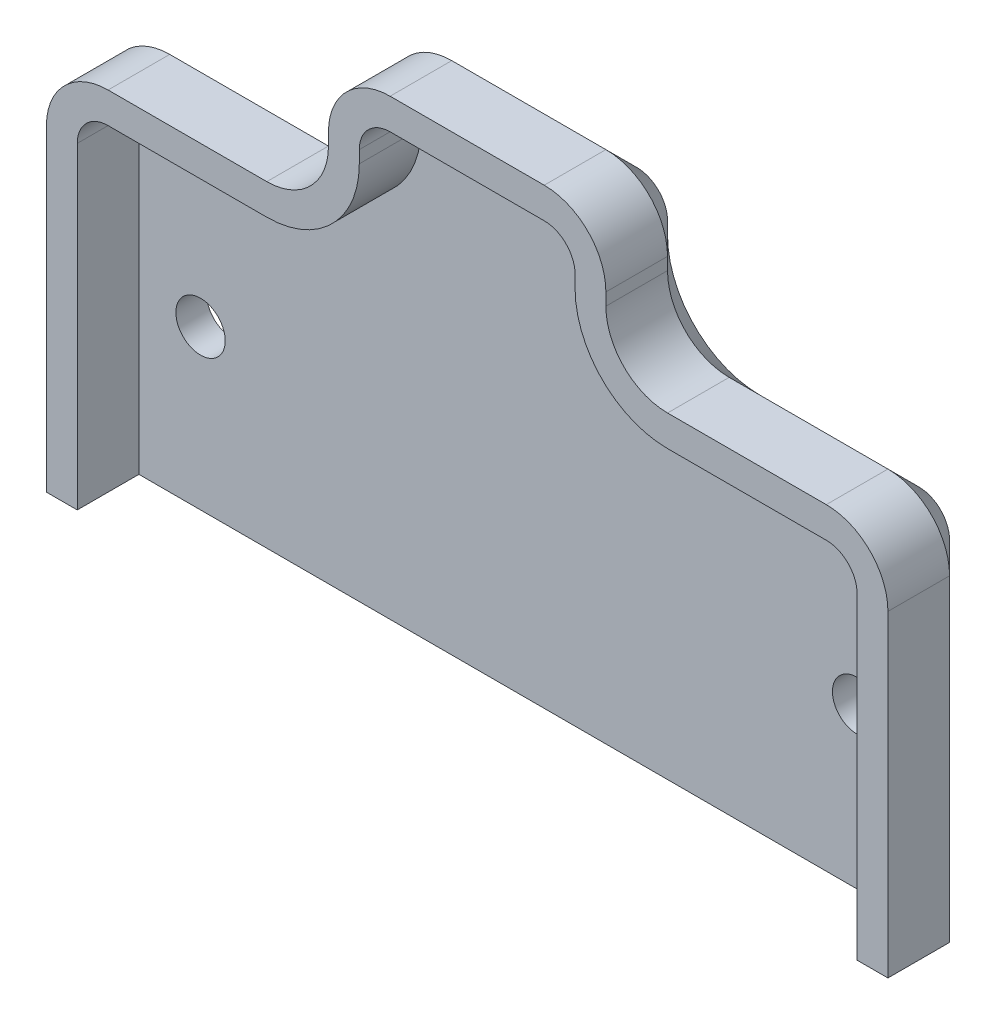
from build123d import *

# Parameters (mm, degrees)
BOSS_EXTRUDE1_DEPTH = 1
BOSS_EXTRUDE2_DEPTH = 2
FILLET1_R           = 1
FILLET2_R           = 2
FILLET3_R           = 3
SKETCH3_R           = 0.8
CUT_EXTRUDE1_DEPTH  = 38.344114593
CHAMFER1_SIZE       = 1


with BuildPart() as part:
    # Sketch1 → Boss-Extrude1 (new body)
    with BuildSketch(Plane.XY):
        Polygon((26.816301055, 5.1920844), (35.966301055, 5.1920844), (35.966301055, -7.1079156), (8.666301055, -7.1079156), (8.666301055, 5.1920844), (17.816301055, 5.1920844), (17.816301055, 9.5920844), (26.816301055, 9.5920844), align=None)
    extrude(amount=BOSS_EXTRUDE1_DEPTH)

    # Sketch2 → Boss-Extrude2 (add)
    with BuildSketch(Plane.XY.offset(1)):
        Polygon((34.966301055, -7.1079156), (34.966301055, 4.1920844), (25.816301055, 4.1920844), (25.816301055, 8.5920844), (18.816301055, 8.5920844), (18.816301055, 4.1920844), (9.666301055, 4.1920844), (9.666301055, -7.1079156), (8.666301055, -7.1079156), (8.666301055, 5.1920844), (17.816301055, 5.1920844), (17.816301055, 9.5920844), (26.816301055, 9.5920844), (26.816301055, 5.1920844), (35.966301055, 5.1920844), (35.966301055, -7.1079156), align=None)
    extrude(amount=BOSS_EXTRUDE2_DEPTH)

    # Fillet1
    fillet1_edges = [part.edges().sort_by_distance(p)[0] for p in [
        (9.666301055, 4.1920844, 2),
        (18.816301055, 8.5920844, 2),
        (25.816301055, 8.5920844, 2),
        (34.966301055, 4.1920844, 2),
    ]]
    fillet(fillet1_edges, radius=FILLET1_R)

    # Fillet2
    fillet2_edges = [part.edges().sort_by_distance(p)[0] for p in [
        (8.666301055, 5.1920844, 1.5),
        (17.816301055, 5.1920844, 1.5),
        (17.816301055, 9.5920844, 1.5),
        (26.816301055, 9.5920844, 1.5),
        (26.816301055, 5.1920844, 1.5),
        (35.966301055, 5.1920844, 1.5),
    ]]
    fillet(fillet2_edges, radius=FILLET2_R)

    # Fillet3
    fillet3_edges = [part.edges().sort_by_distance(p)[0] for p in [
        (18.816301055, 4.1920844, 2),
        (25.816301055, 4.1920844, 2),
    ]]
    fillet(fillet3_edges, radius=FILLET3_R)

    # Sketch3 → Cut-Extrude1 (cut, through all)
    with BuildSketch(Plane(origin=(0, 0, 0), x_dir=(-1, 0, 0), z_dir=(0, 0, -1))):
        with Locations((-32.966301055, -1.9579156)):
            Circle(SKETCH3_R)
        with Locations((-11.666301055, -1.9579156)):
            Circle(SKETCH3_R)
    extrude(amount=-CUT_EXTRUDE1_DEPTH, mode=Mode.SUBTRACT)

    # Chamfer1
    chamfer1_edges = [part.edges().sort_by_distance(p)[0] for p in [
        (13.241301055, 5.1920844, 0),
        (17.816301055, 7.3920844, 0),
        (8.666301055, -1.9579156, 0),
        (35.966301055, -1.9579156, 0),
        (22.316301055, 9.5920844, 0),
        (26.230514617, 9.006297963, 0),
        (18.402087492, 9.006297963, 0),
        (35.380514617, 4.606297963, 0),
        (9.252087492, 4.606297963, 0),
        (27.402087492, 5.777870838, 0),
        (17.230514617, 5.777870838, 0),
        (26.816301055, 7.3920844, 0),
        (31.391301055, 5.1920844, 0),
    ]]
    chamfer(chamfer1_edges, length=CHAMFER1_SIZE)


solid = part.part
